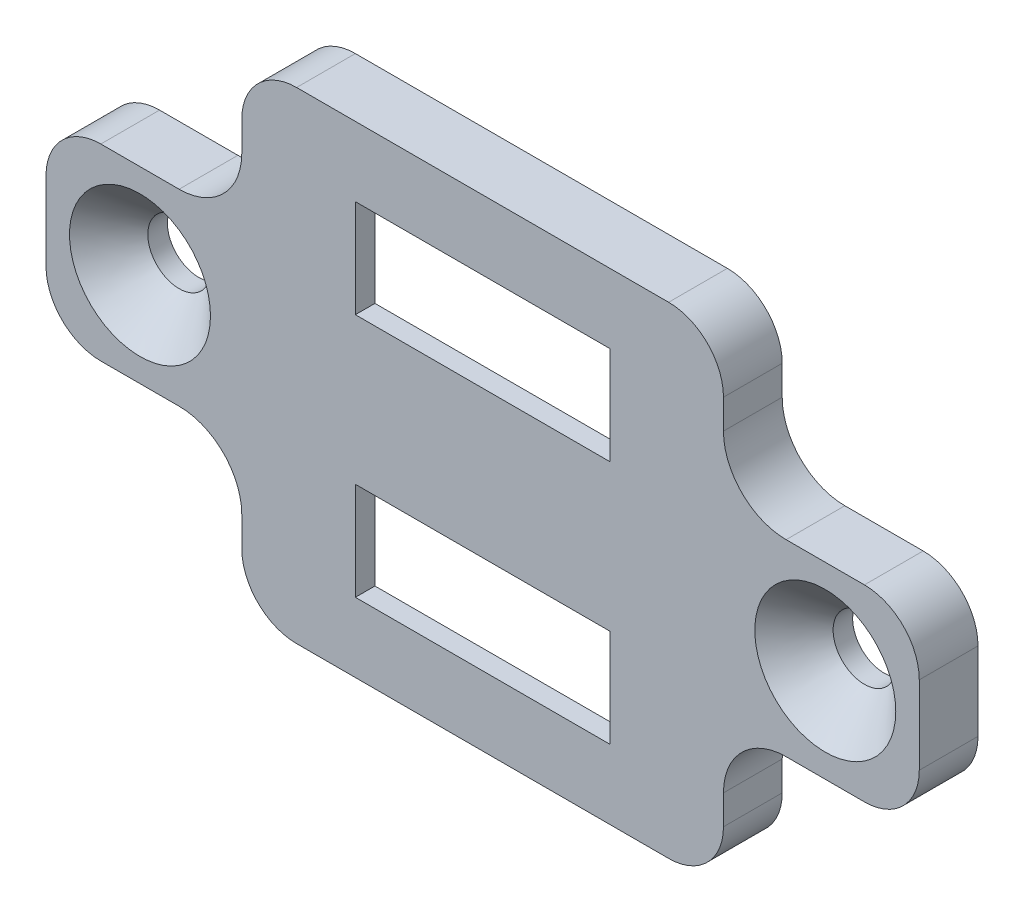
from build123d import *

# Parameters (mm, degrees)
ESQUISSE1_R             = 1.6
BOSS_EXTRU_1_DEPTH      = 3
ENL_V_MAT_EXTRU_1_DEPTH = 2
ESQUISSE4_W             = 13
ESQUISSE4_H             = 5
ENL_V_MAT_EXTRU_2_DEPTH = 26.545645421
CHANFREIN1_SIZE         = 2


with BuildPart() as part:
    # Esquisse1 → Boss.-Extru.1 (new body)
    with BuildSketch(Plane.XY):
        with BuildLine():
            Line((-9.5, 12.3), (9.5, 12.3))
            ThreePointArc((9.5, 12.3), (11.479898987, 11.479898987), (12.3, 9.5))
            Line((12.3, 9.5), (12.3, 8))
            ThreePointArc((12.3, 8), (13.2372583, 5.7372583), (15.5, 4.8))
            Line((15.5, 4.8), (19.5, 4.8))
            ThreePointArc((19.5, 4.8), (21.479898987, 3.979898987), (22.3, 2))
            Line((22.3, 2), (22.3, -2))
            ThreePointArc((22.3, -2), (21.479898987, -3.979898987), (19.5, -4.8))
            Line((19.5, -4.8), (15.5, -4.8))
            ThreePointArc((15.5, -4.8), (13.2372583, -5.7372583), (12.3, -8))
            Line((12.3, -8), (12.3, -9.5))
            ThreePointArc((12.3, -9.5), (11.479898987, -11.479898987), (9.5, -12.3))
            Line((9.5, -12.3), (-9.5, -12.3))
            ThreePointArc((-9.5, -12.3), (-11.479898987, -11.479898987), (-12.3, -9.5))
            Line((-12.3, -9.5), (-12.3, -8))
            ThreePointArc((-12.3, -8), (-13.2372583, -5.7372583), (-15.5, -4.8))
            Line((-15.5, -4.8), (-19.5, -4.8))
            ThreePointArc((-19.5, -4.8), (-21.479898987, -3.979898987), (-22.3, -2))
            Line((-22.3, -2), (-22.3, 2))
            ThreePointArc((-22.3, 2), (-21.479898987, 3.979898987), (-19.5, 4.8))
            Line((-19.5, 4.8), (-15.5, 4.8))
            ThreePointArc((-15.5, 4.8), (-13.2372583, 5.7372583), (-12.3, 8))
            Line((-12.3, 8), (-12.3, 9.5))
            ThreePointArc((-12.3, 9.5), (-11.479898987, 11.479898987), (-9.5, 12.3))
        make_face()
        with Locations((-17.5, 0)):
            Circle(ESQUISSE1_R, mode=Mode.SUBTRACT)
        with Locations((17.5, 0)):
            Circle(ESQUISSE1_R, mode=Mode.SUBTRACT)
    extrude(amount=BOSS_EXTRU_1_DEPTH)

    # Esquisse2 → Enlèv. mat.-Extru.1 (cut)
    with BuildSketch(Plane(origin=(0, 0, 0), x_dir=(-1, 0, 0), z_dir=(0, 0, -1))):
        with BuildLine():
            Line((-8.75, 11.75), (8.75, 11.75))
            ThreePointArc((8.75, 11.75), (10.871320344, 10.871320344), (11.75, 8.75))
            Line((11.75, 8.75), (11.75, -8.75))
            ThreePointArc((11.75, -8.75), (10.871320344, -10.871320344), (8.75, -11.75))
            Line((8.75, -11.75), (-8.75, -11.75))
            ThreePointArc((-8.75, -11.75), (-10.871320344, -10.871320344), (-11.75, -8.75))
            Line((-11.75, -8.75), (-11.75, 8.75))
            ThreePointArc((-11.75, 8.75), (-10.871320344, 10.871320344), (-8.75, 11.75))
        make_face()
    extrude(amount=-ENL_V_MAT_EXTRU_1_DEPTH, mode=Mode.SUBTRACT)

    # Esquisse4 → Enlèv. mat.-Extru.2 (cut, through all)
    with BuildSketch(Plane(origin=(0, 0, 2), x_dir=(-1, 0, 0), z_dir=(0, 0, -1))):
        with Locations((0, 6.25)):
            Rectangle(ESQUISSE4_W, ESQUISSE4_H)
        with Locations((0, -6.25)):
            Rectangle(ESQUISSE4_W, ESQUISSE4_H)
    extrude(amount=-ENL_V_MAT_EXTRU_2_DEPTH, mode=Mode.SUBTRACT)

    # Chanfrein1
    chanfrein1_edges = [part.edges().sort_by_distance(p)[0] for p in [
        (-19.1, 0, 3),
        (15.9, 0, 3),
    ]]
    chamfer(chanfrein1_edges, length=CHANFREIN1_SIZE)


solid = part.part
